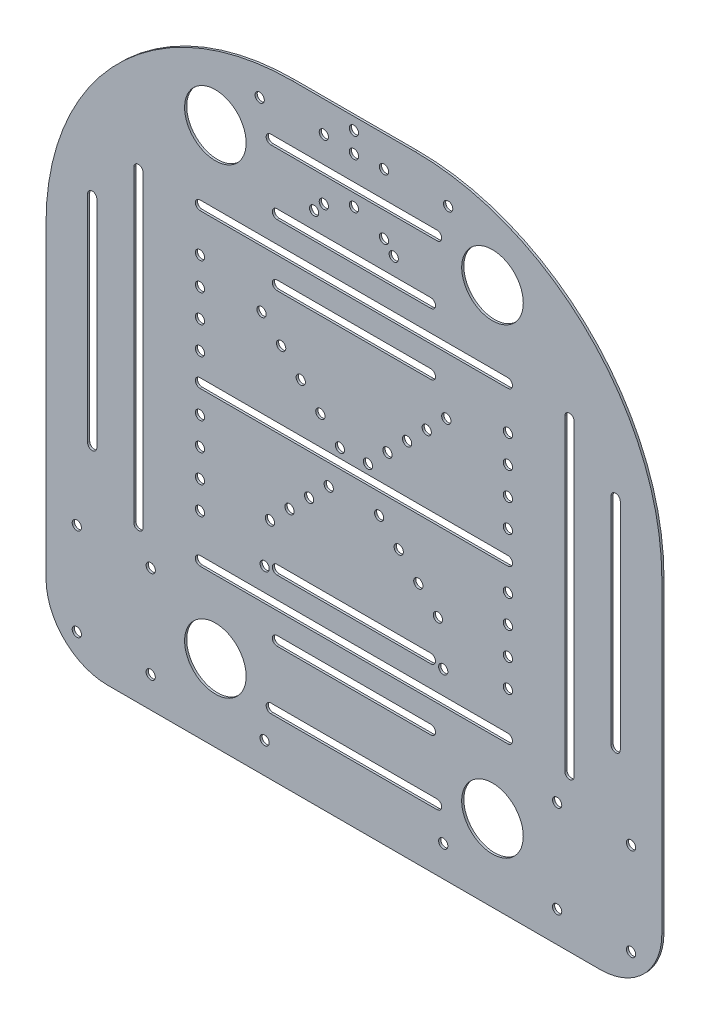
from build123d import *

# Parameters (mm, degrees)
SKETCH_1_R          = 1.5
SKETCH_1_R_2        = 10
EXTRUDE_1_DEPTH     = 0.7
SKETCH_2_R          = 1.5
CUT_EXTRUDE_1_DEPTH = 40
SKETCH_4_R          = 1.5
CUT_EXTRUDE_2_DEPTH = 10


with BuildPart() as part:
    # 草图1 → 凸台-拉伸1 (new body)
    with BuildSketch(Plane.XY):
        with BuildLine():
            Line((20, 100), (-20, 100))
            ThreePointArc((-20, 100), (-76.568542495, 76.568542495), (-100, 20))
            Line((-100, 20), (-100, -80))
            ThreePointArc((-100, -80), (-94.142135624, -94.142135624), (-80, -100))
            Line((-80, -100), (80, -100))
            ThreePointArc((80, -100), (94.142135624, -94.142135624), (100, -80))
            Line((100, -80), (100, 20))
            ThreePointArc((100, 20), (76.568542495, 76.568542495), (20, 100))
        make_face()
        with Locations((-90, -90)):
            Circle(SKETCH_1_R, mode=Mode.SUBTRACT)
        with Locations((-66, -90)):
            Circle(SKETCH_1_R, mode=Mode.SUBTRACT)
        with Locations((-90, -60)):
            Circle(SKETCH_1_R, mode=Mode.SUBTRACT)
        with Locations((-66, -60)):
            Circle(SKETCH_1_R, mode=Mode.SUBTRACT)
        with Locations((-29, -90)):
            Circle(SKETCH_1_R, mode=Mode.SUBTRACT)
        with Locations((-45, -75)):
            Circle(SKETCH_1_R_2, mode=Mode.SUBTRACT)
        with Locations((-50, -36)):
            Circle(SKETCH_1_R, mode=Mode.SUBTRACT)
        with Locations((-50, -27)):
            Circle(SKETCH_1_R, mode=Mode.SUBTRACT)
        with BuildLine():
            ThreePointArc((-86.5, 35), (-85, 36.5), (-83.5, 35))
            Line((-83.5, 35), (-83.5, -35))
            ThreePointArc((-83.5, -35), (-85, -36.5), (-86.5, -35))
            Line((-86.5, -35), (-86.5, 35))
        make_face(mode=Mode.SUBTRACT)
        with Locations((-50, -18)):
            Circle(SKETCH_1_R, mode=Mode.SUBTRACT)
        with BuildLine():
            ThreePointArc((-68.5, -50), (-70, -51.5), (-71.5, -50))
            Line((-71.5, -50), (-71.5, 50))
            ThreePointArc((-71.5, 50), (-70, 51.5), (-68.5, 50))
            Line((-68.5, 50), (-68.5, -50))
        make_face(mode=Mode.SUBTRACT)
        with Locations((-50, -9)):
            Circle(SKETCH_1_R, mode=Mode.SUBTRACT)
        with Locations((-29, -41)):
            Circle(SKETCH_1_R, mode=Mode.SUBTRACT)
        with Locations((-27.275649276, -27.275649276)):
            Circle(SKETCH_1_R, mode=Mode.SUBTRACT)
        with Locations((-20.911688245, -20.911688245)):
            Circle(SKETCH_1_R, mode=Mode.SUBTRACT)
        with Locations((-14.547727215, -14.547727215)):
            Circle(SKETCH_1_R, mode=Mode.SUBTRACT)
        with Locations((-8.183766184, -8.183766184)):
            Circle(SKETCH_1_R, mode=Mode.SUBTRACT)
        with BuildLine():
            ThreePointArc((-27, -81.5), (-28.5, -80), (-27, -78.5))
            Line((-27, -78.5), (27, -78.5))
            ThreePointArc((27, -78.5), (28.5, -80), (27, -81.5))
            Line((27, -81.5), (-27, -81.5))
        make_face(mode=Mode.SUBTRACT)
        with Locations((29, -90)):
            Circle(SKETCH_1_R, mode=Mode.SUBTRACT)
        with Locations((45, -75)):
            Circle(SKETCH_1_R_2, mode=Mode.SUBTRACT)
        with BuildLine():
            Line((25, -61.5), (-25, -61.5))
            ThreePointArc((-25, -61.5), (-26.5, -60), (-25, -58.5))
            Line((-25, -58.5), (25, -58.5))
            ThreePointArc((25, -58.5), (26.5, -60), (25, -61.5))
        make_face(mode=Mode.SUBTRACT)
        with Locations((66, -90)):
            Circle(SKETCH_1_R, mode=Mode.SUBTRACT)
        with Locations((90, -90)):
            Circle(SKETCH_1_R, mode=Mode.SUBTRACT)
        with Locations((66, -60)):
            Circle(SKETCH_1_R, mode=Mode.SUBTRACT)
        with Locations((90, -60)):
            Circle(SKETCH_1_R, mode=Mode.SUBTRACT)
        with BuildLine():
            Line((50, -51.5), (-50, -51.5))
            ThreePointArc((-50, -51.5), (-51.5, -50), (-50, -48.5))
            Line((-50, -48.5), (50, -48.5))
            ThreePointArc((50, -48.5), (51.5, -50), (50, -51.5))
        make_face(mode=Mode.SUBTRACT)
        with BuildLine():
            Line((25, -41.5), (-25, -41.5))
            ThreePointArc((-25, -41.5), (-26.5, -40), (-25, -38.5))
            Line((-25, -38.5), (25, -38.5))
            ThreePointArc((25, -38.5), (26.5, -40), (25, -41.5))
        make_face(mode=Mode.SUBTRACT)
        with Locations((29, -41)):
            Circle(SKETCH_1_R, mode=Mode.SUBTRACT)
        with Locations((27.275649276, -27.275649276)):
            Circle(SKETCH_1_R, mode=Mode.SUBTRACT)
        with Locations((20.911688245, -20.911688245)):
            Circle(SKETCH_1_R, mode=Mode.SUBTRACT)
        with Locations((14.547727215, -14.547727215)):
            Circle(SKETCH_1_R, mode=Mode.SUBTRACT)
        with Locations((8.183766184, -8.183766184)):
            Circle(SKETCH_1_R, mode=Mode.SUBTRACT)
        with BuildLine():
            ThreePointArc((-50, -1.5), (-51.5, 0), (-50, 1.5))
            Line((-50, 1.5), (50, 1.5))
            ThreePointArc((50, 1.5), (51.5, 0), (50, -1.5))
            Line((50, -1.5), (-50, -1.5))
        make_face(mode=Mode.SUBTRACT)
        with Locations((50, -36)):
            Circle(SKETCH_1_R, mode=Mode.SUBTRACT)
        with Locations((50, -27)):
            Circle(SKETCH_1_R, mode=Mode.SUBTRACT)
        with Locations((50, -18)):
            Circle(SKETCH_1_R, mode=Mode.SUBTRACT)
        with Locations((50, -9)):
            Circle(SKETCH_1_R, mode=Mode.SUBTRACT)
        with Locations((-50, 9)):
            Circle(SKETCH_1_R, mode=Mode.SUBTRACT)
        with Locations((-50, 18)):
            Circle(SKETCH_1_R, mode=Mode.SUBTRACT)
        with Locations((-50, 27)):
            Circle(SKETCH_1_R, mode=Mode.SUBTRACT)
        with Locations((-50, 36)):
            Circle(SKETCH_1_R, mode=Mode.SUBTRACT)
        with Locations((-4.544155877, 4.544155877)):
            Circle(SKETCH_1_R, mode=Mode.SUBTRACT)
        with Locations((-10.908116908, 10.908116908)):
            Circle(SKETCH_1_R, mode=Mode.SUBTRACT)
        with Locations((-17.272077939, 17.272077939)):
            Circle(SKETCH_1_R, mode=Mode.SUBTRACT)
        with Locations((-23.636038969, 23.636038969)):
            Circle(SKETCH_1_R, mode=Mode.SUBTRACT)
        with Locations((-30, 30)):
            Circle(SKETCH_1_R, mode=Mode.SUBTRACT)
        with BuildLine():
            ThreePointArc((-50, 48.5), (-51.5, 50), (-50, 51.5))
            Line((-50, 51.5), (50, 51.5))
            ThreePointArc((50, 51.5), (51.5, 50), (50, 48.5))
            Line((50, 48.5), (-50, 48.5))
        make_face(mode=Mode.SUBTRACT)
        with Locations((-45, 75)):
            Circle(SKETCH_1_R_2, mode=Mode.SUBTRACT)
        with Locations((-9.77, 70.46)):
            Circle(SKETCH_1_R, mode=Mode.SUBTRACT)
        with Locations((-9.77, 90)):
            Circle(SKETCH_1_R, mode=Mode.SUBTRACT)
        with Locations((4.544155877, 4.544155877)):
            Circle(SKETCH_1_R, mode=Mode.SUBTRACT)
        with Locations((10.908116908, 10.908116908)):
            Circle(SKETCH_1_R, mode=Mode.SUBTRACT)
        with Locations((17.272077939, 17.272077939)):
            Circle(SKETCH_1_R, mode=Mode.SUBTRACT)
        with Locations((23.636038969, 23.636038969)):
            Circle(SKETCH_1_R, mode=Mode.SUBTRACT)
        with BuildLine():
            ThreePointArc((-25, 38.5), (-26.5, 40), (-25, 41.5))
            Line((-25, 41.5), (25, 41.5))
            ThreePointArc((25, 41.5), (26.5, 40), (25, 38.5))
            Line((25, 38.5), (-25, 38.5))
        make_face(mode=Mode.SUBTRACT)
        with Locations((30, 30)):
            Circle(SKETCH_1_R, mode=Mode.SUBTRACT)
        with Locations((50, 9)):
            Circle(SKETCH_1_R, mode=Mode.SUBTRACT)
        with BuildLine():
            Line((71.5, 50), (71.5, -50))
            ThreePointArc((71.5, -50), (70, -51.5), (68.5, -50))
            Line((68.5, -50), (68.5, 50))
            ThreePointArc((68.5, 50), (70, 51.5), (71.5, 50))
        make_face(mode=Mode.SUBTRACT)
        with Locations((50, 18)):
            Circle(SKETCH_1_R, mode=Mode.SUBTRACT)
        with BuildLine():
            Line((83.5, -35), (83.5, 35))
            ThreePointArc((83.5, 35), (85, 36.5), (86.5, 35))
            Line((86.5, 35), (86.5, -35))
            ThreePointArc((86.5, -35), (85, -36.5), (83.5, -35))
        make_face(mode=Mode.SUBTRACT)
        with Locations((50, 27)):
            Circle(SKETCH_1_R, mode=Mode.SUBTRACT)
        with Locations((50, 36)):
            Circle(SKETCH_1_R, mode=Mode.SUBTRACT)
        with BuildLine():
            ThreePointArc((-25, 58.5), (-26.5, 60), (-25, 61.5))
            Line((-25, 61.5), (25, 61.5))
            ThreePointArc((25, 61.5), (26.5, 60), (25, 58.5))
            Line((25, 58.5), (-25, 58.5))
        make_face(mode=Mode.SUBTRACT)
        with Locations((9.77, 70.46)):
            Circle(SKETCH_1_R, mode=Mode.SUBTRACT)
        with Locations((45, 75)):
            Circle(SKETCH_1_R_2, mode=Mode.SUBTRACT)
        with BuildLine():
            Line((27, 78.5), (-27, 78.5))
            ThreePointArc((-27, 78.5), (-28.5, 80), (-27, 81.5))
            Line((-27, 81.5), (27, 81.5))
            ThreePointArc((27, 81.5), (28.5, 80), (27, 78.5))
        make_face(mode=Mode.SUBTRACT)
        with Locations((9.77, 90)):
            Circle(SKETCH_1_R, mode=Mode.SUBTRACT)
    extrude(amount=EXTRUDE_1_DEPTH)

    # 草图2 → 切除-拉伸1 (cut)
    with BuildSketch(Plane.XY.offset(0.7)):
        with Locations((24973, 94.93)):
            Circle(SKETCH_2_R)
        with Locations((0, 89.43)):
            Circle(SKETCH_2_R)
        with Locations((12.929759279, 67.035)):
            Circle(SKETCH_2_R)
        with Locations((-12.929759279, 67.035)):
            Circle(SKETCH_2_R)
        with Locations((0, 74.5)):
            Circle(SKETCH_2_R)
    extrude(amount=-CUT_EXTRUDE_1_DEPTH, mode=Mode.SUBTRACT)

    # 草图4 → 切除-拉伸2 (cut)
    with BuildSketch(Plane.XY.offset(0.7)):
        with Locations((0, 96)):
            Circle(SKETCH_4_R)
        with Locations((-30.608507012, 90)):
            Circle(SKETCH_4_R)
        with Locations((30.608507012, 90)):
            Circle(SKETCH_4_R)
    extrude(amount=-CUT_EXTRUDE_2_DEPTH, mode=Mode.SUBTRACT)


solid = part.part
